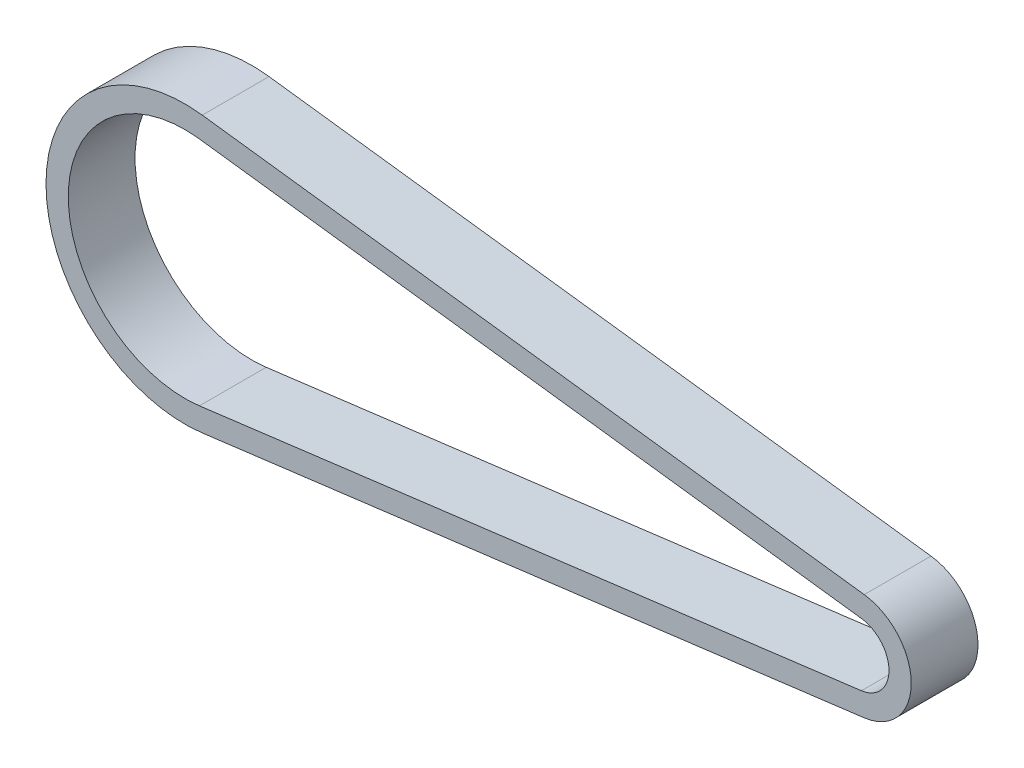
from build123d import *

# Parameters (mm, degrees)
RESSALTO_EXTRUS_O1_DEPTH = 4.5


with BuildPart() as part:
    # Esboço1 → Ressalto-extrusão1 (new, symmetric)
    with BuildSketch(Plane.XY):
        with BuildLine():
            ThreePointArc((91.591504601, -7.191966904), (97.92602, 0), (91.591504601, 7.191966904))
            Line((91.591504601, 7.191966904), (2.361318902, 18.550314635))
            ThreePointArc((2.361318902, 18.550314635), (-18.7, 0), (2.361318902, -18.550314635))
            Line((2.361318902, -18.550314635), (91.591504601, -7.191966904))
        make_face()
        with BuildLine():
            ThreePointArc((1.982497688, -15.57432833), (-15.7, 0), (1.982497688, 15.57432833))
            Line((1.982497688, 15.57432833), (91.212683387, 4.215980599))
            ThreePointArc((91.212683387, 4.215980599), (94.92602, 0), (91.212683387, -4.215980599))
            Line((91.212683387, -4.215980599), (1.982497688, -15.57432833))
        make_face(mode=Mode.SUBTRACT)
    extrude(amount=RESSALTO_EXTRUS_O1_DEPTH, both=True)


solid = part.part
